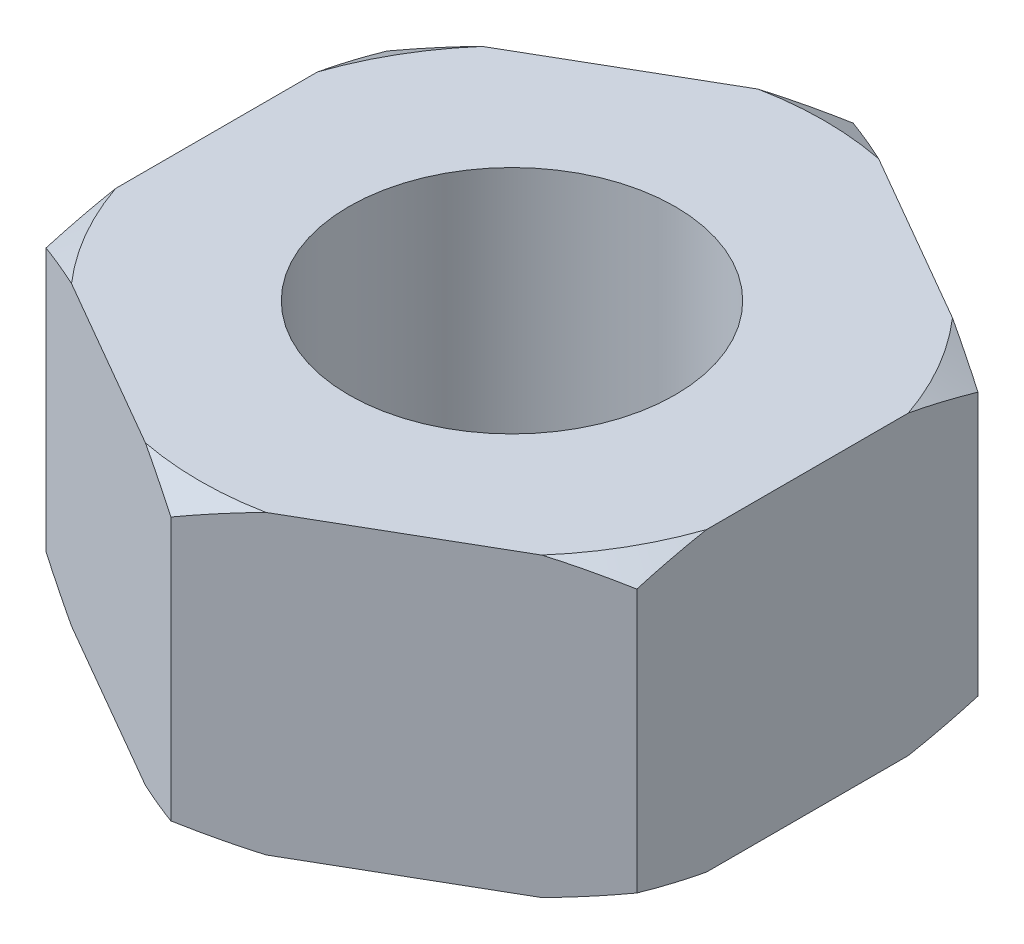
from build123d import *

# Parameters (mm, degrees)
SKETCH_1_R          = 3.85
EXTRUDE_1_DEPTH     = 3
CHAMFER_6_SIZE      = 0.4
CHAMFER_6_SIZE2     = 0.692820323
CHAMFER_7_SIZE      = 0.4
CHAMFER_7_SIZE2     = 0.692820323
SKETCH_3_OUTSIDE_W  = 11.96
SKETCH_3_OUTSIDE_H  = 11.96
CUT_EXTRUDE_4_DEPTH = 3
HOLE_WIZARD_M42_D   = 3.3


with BuildPart() as part:
    # Эскиз1 → Бобышка-Вытянуть1 (new body)
    with BuildSketch(Plane(origin=(0, 0, 0), x_dir=(1, 0, 0), z_dir=(0, 1, 0))):
        with Locations(Location((0, 0, 0), (0, 0, 270))):
            Circle(SKETCH_1_R)
    extrude(amount=EXTRUDE_1_DEPTH)

    # Фаска6
    chamfer_6_edges = [part.edges().sort_by_distance(p)[0] for p in [
        (0, 0, -3.85),
    ]]
    chamfer_6_side = [part.faces().sort_by_distance(p)[0] for p in [
        (0, 1.5, -3.85),
    ]]
    chamfer(chamfer_6_edges, length=CHAMFER_6_SIZE, length2=CHAMFER_6_SIZE2, reference=chamfer_6_side[0])

    # Фаска7
    chamfer_7_edges = [part.edges().sort_by_distance(p)[0] for p in [
        (0, 3, -3.85),
    ]]
    chamfer_7_side = [part.faces().sort_by_distance(p)[0] for p in [
        (0, 1.7, -3.85),
    ]]
    chamfer(chamfer_7_edges, length=CHAMFER_7_SIZE, length2=CHAMFER_7_SIZE2, reference=chamfer_7_side[0])

    # Эскиз3 outside → Вырез-Вытянуть4 (cut)
    with BuildSketch(Plane(origin=(0, 3, 0), x_dir=(1, 0, 0), z_dir=(0, 1, 0))):
        Rectangle(SKETCH_3_OUTSIDE_W, SKETCH_3_OUTSIDE_H)
        Polygon((2.987787643, -1.725), (2.987787643, 1.725), (0, 3.45), (-2.987787643, 1.725), (-2.987787643, -1.725), (0, -3.45), align=None, mode=Mode.SUBTRACT)
    extrude(amount=-CUT_EXTRUDE_4_DEPTH, mode=Mode.SUBTRACT)

    # Отверстие обработанное метчиком M42 (through all)
    with Locations(Plane(origin=(0, 0, 0), x_dir=(-1, 0, 0), z_dir=(0, -1, 0))):
        with Locations((0, 0)):
            Hole(HOLE_WIZARD_M42_D / 2)


solid = part.part
